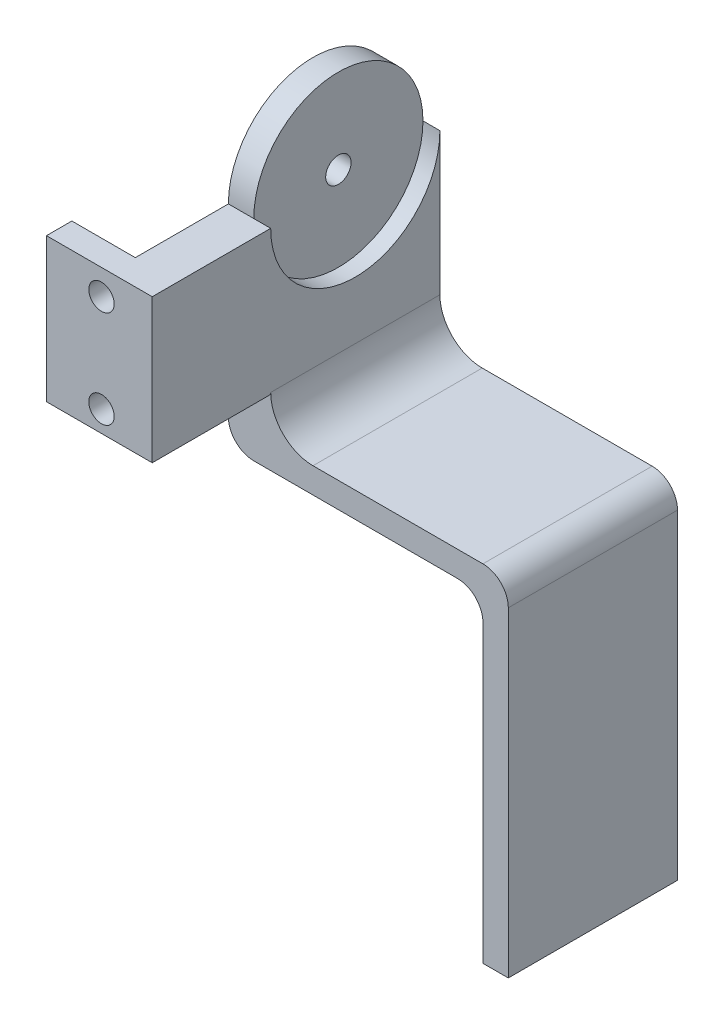
from build123d import *

# Parameters (mm, degrees)
BOSS_EXTRUDE1_DEPTH      = 20
CUT_EXTRUDE1_DEPTH       = 3
SKETCH4_W                = 3
SKETCH4_H                = 17
BOSS_EXTRUDE2_DEPTH      = 14
SKETCH6_W                = 3
SKETCH6_H                = 17
BOSS_EXTRUDE3_DEPTH      = 7.5
SKETCH7_R                = 1.5
CUT_EXTRUDE3_DEPTH       = 7.5
SKETCH8_R                = 1.5
CUT_EXTRUDE4_DEPTH       = 10
SKETCH10_R               = 3
CUT_EXTRUDE6_DEPTH       = 8
BOSS_EXTRUDE4_DEPTH      = 2
BOSS_EXTRUDE4_DEPTH_BACK = 2
SKETCH12_W               = 14
SKETCH12_H               = 17
BOSS_EXTRUDE5_DEPTH      = 2
BOSS_EXTRUDE6_DEPTH      = 2
BOSS_EXTRUDE7_DEPTH      = 20


with BuildPart() as part:
    # Sketch1 → Boss-Extrude1 (new body)
    with BuildSketch(Plane.XY):
        with BuildLine():
            Line((-3, -6), (-3, -40.891511))
            Line((-3, -40.891511), (0, -40.891511))
            Line((0, -40.891511), (0, -3))
            ThreePointArc((0, -3), (-0.878679656, -0.878679656), (-3, 0))
            Line((-3, 0), (-27.084538342, 0))
            ThreePointArc((-27.084538342, 0), (-29.205858686, 0.878679656), (-30.084538342, 3))
            Line((-30.084538342, 3), (-30.084538342, 31.8))
            Line((-30.084538342, 31.8), (-33.084538342, 31.8))
            Line((-33.084538342, 31.8), (-33.084538342, 0))
            ThreePointArc((-33.084538342, 0), (-32.205858686, -2.121320344), (-30.084538342, -3))
            Line((-30.084538342, -3), (-6, -3))
            ThreePointArc((-6, -3), (-3.878679656, -3.878679656), (-3, -6))
        make_face()
    extrude(amount=BOSS_EXTRUDE1_DEPTH)

    # Sketch2 → Cut-Extrude1 (cut)
    with BuildSketch(Plane(origin=(-30.084538342, 0, 0), x_dir=(0, 0, -1), z_dir=(1, 0, 0))):
        with BuildLine():
            ThreePointArc((-10, 31.8), (-2.928932188, 28.871067812), (0, 21.8))
            Line((0, 21.8), (0, 31.8))
            Line((0, 31.8), (-10, 31.8))
        make_face()
        with BuildLine():
            ThreePointArc((-20, 21.8), (-17.071067812, 28.871067812), (-10, 31.8))
            Line((-10, 31.8), (-20, 31.8))
            Line((-20, 31.8), (-20, 21.8))
        make_face()
    extrude(amount=-CUT_EXTRUDE1_DEPTH, mode=Mode.SUBTRACT)

    # Sketch4 → Boss-Extrude2 (add)
    with BuildSketch(Plane.XY.offset(20)):
        with Locations((-31.584538342, 13.3)):
            Rectangle(SKETCH4_W, SKETCH4_H)
    extrude(amount=BOSS_EXTRUDE2_DEPTH)

    # Sketch6 → Boss-Extrude3 (add)
    with BuildSketch(Plane.ZY.offset(33.084538342)):
        with Locations((32.5, 13.3)):
            Rectangle(SKETCH6_W, SKETCH6_H)
    extrude(amount=BOSS_EXTRUDE3_DEPTH)

    # Sketch7 → Cut-Extrude3 (cut)
    with BuildSketch(Plane(origin=(0, 0, 31), x_dir=(-1, 0, 0), z_dir=(0, 0, -1))):
        with Locations(Location((34.084538342, 18.8, 0), (0, 0, 131.810314896))):
            Circle(SKETCH7_R)
        with Locations(Location((34.084538342, 7.3, 0), (0, 0, 131.810314896))):
            Circle(SKETCH7_R)
    extrude(amount=-CUT_EXTRUDE3_DEPTH, mode=Mode.SUBTRACT)

    # Sketch8 → Cut-Extrude4 (cut)
    with BuildSketch(Plane.ZY.offset(33.084538342)):
        with Locations(Location((10, 21.8, 0), (0, 0, 270))):
            Circle(SKETCH8_R)
    extrude(amount=-CUT_EXTRUDE4_DEPTH, mode=Mode.SUBTRACT)

    # Sketch10 → Cut-Extrude6 (cut)
    with BuildSketch(Plane(origin=(0, 0, 31), x_dir=(-1, 0, 0), z_dir=(0, 0, -1))):
        with Locations((34.084538342, 7.3)):
            Circle(SKETCH10_R)
        with Locations((34.084538342, 18.8)):
            Circle(SKETCH10_R)
    extrude(amount=CUT_EXTRUDE6_DEPTH, mode=Mode.SUBTRACT)

    # Sketch11 → Boss-Extrude4 (add, two sides: drawn at the far end of the back side and taken through both)
    with BuildSketch(Plane(origin=(0, 13.3, 0), x_dir=(1, 0, 0), z_dir=(0, 1, 0)).offset(-BOSS_EXTRUDE4_DEPTH_BACK)):
        Polygon((-33.084538342, -25.5), (-33.084538342, -31), (-40.584538342, -31), align=None)
    extrude(amount=BOSS_EXTRUDE4_DEPTH + BOSS_EXTRUDE4_DEPTH_BACK)

    # Sketch12 → Boss-Extrude5 (add)
    with BuildSketch(Plane(origin=(-30.084538342, 0, 0), x_dir=(0, 0, -1), z_dir=(1, 0, 0))):
        with Locations((-27, 13.3)):
            Rectangle(SKETCH12_W, SKETCH12_H)
    extrude(amount=BOSS_EXTRUDE5_DEPTH)

    # Sketch15 → Boss-Extrude6 (add)
    with BuildSketch(Plane(origin=(-30.084538342, 0, 0), x_dir=(0, 0, -1), z_dir=(1, 0, 0))):
        with BuildLine():
            Line((0, 21.8), (0, 0))
            Line((0, 0), (-20, 0))
            Line((-20, 0), (-20, 21.8))
            ThreePointArc((-20, 21.8), (-10, 11.8), (0, 21.8))
        make_face()
    extrude(amount=BOSS_EXTRUDE6_DEPTH)

    # Sketch16 → Boss-Extrude7 (add)
    with BuildSketch(Plane(origin=(0, 0, 0), x_dir=(-1, 0, 0), z_dir=(0, 0, -1))):
        with BuildLine():
            Line((28.084538342, 0), (23.084538342, 0))
            ThreePointArc((23.084538342, 0), (26.620072248, 1.464466094), (28.084538342, 5))
            Line((28.084538342, 5), (28.084538342, 0))
        make_face()
    extrude(amount=-BOSS_EXTRUDE7_DEPTH)


solid = part.part
